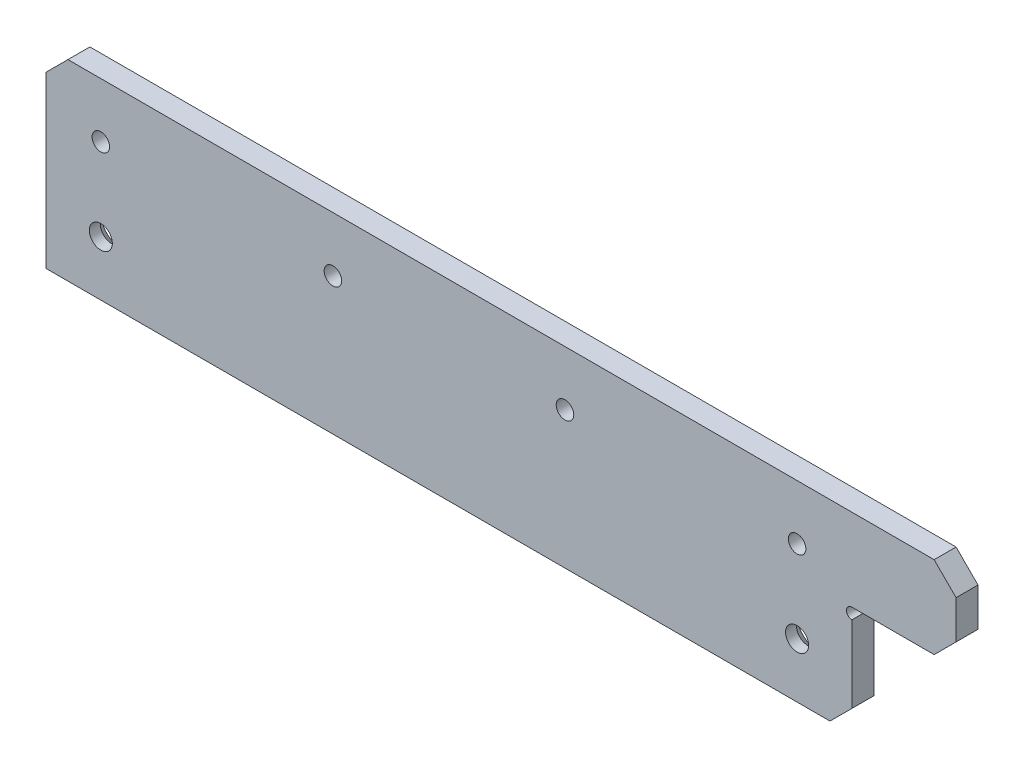
from build123d import *

# Parameters (mm, degrees)
SKETCH_1_W          = 147
SKETCH_1_H          = 35
EXTRUDE_1_DEPTH     = 2
SKETCH_2_W          = 19
SKETCH_2_H          = 15
EXTRUDE_2_DEPTH     = 4
SKETCH_3_R          = 2.1
CUT_EXTRUDE_1_DEPTH = 95.225792647
CHAMFER_1_SIZE      = 4
SKETCH_4_R          = 1
CUT_EXTRUDE_2_DEPTH = 95.225792647
SKETCH_5_R          = 1.6
CUT_EXTRUDE_3_DEPTH = 95.225792647
CHAMFER_2_SIZE      = 2


with BuildPart() as part:
    # 草图1 → 凸台-拉伸1 (new, symmetric)
    with BuildSketch(Plane.XY):
        Rectangle(SKETCH_1_W, SKETCH_1_H)
    extrude(amount=EXTRUDE_1_DEPTH, both=True)

    # 草图2 → 凸台-拉伸2 (add)
    with BuildSketch(Plane.XY.offset(2)):
        with Locations((83, 10)):
            Rectangle(SKETCH_2_W, SKETCH_2_H)
    extrude(amount=-EXTRUDE_2_DEPTH)

    # 草图3 → 切除-拉伸1 (cut, through all)
    with BuildSketch(Plane.XY.offset(2)):
        with Locations((-63.5, -7.5)):
            Circle(SKETCH_3_R)
        with Locations((63.5, -7.5)):
            Circle(SKETCH_3_R)
    extrude(amount=-CUT_EXTRUDE_1_DEPTH, mode=Mode.SUBTRACT)

    # 倒角1
    chamfer_1_edges = [part.edges().sort_by_distance(p)[0] for p in [
        (92.5, 17.5, 0),
        (92.5, 2.5, 0),
        (-73.5, 17.5, 0),
        (73.5, -17.5, 0),
    ]]
    chamfer(chamfer_1_edges, length=CHAMFER_1_SIZE)

    # 草图4 → 切除-拉伸2 (cut, through all)
    with BuildSketch(Plane.XY.offset(2)):
        with Locations((73.5, 1.5)):
            Circle(SKETCH_4_R)
    extrude(amount=-CUT_EXTRUDE_2_DEPTH, mode=Mode.SUBTRACT)

    # 草图5 → 切除-拉伸3 (cut, through all)
    with BuildSketch(Plane.XY.offset(2)):
        with Locations((-63.5, 7.5)):
            Circle(SKETCH_5_R)
        with Locations((-21.166666667, 7.5)):
            Circle(SKETCH_5_R)
        with Locations((21.166666667, 7.5)):
            Circle(SKETCH_5_R)
        with Locations((63.5, 7.5)):
            Circle(SKETCH_5_R)
    extrude(amount=-CUT_EXTRUDE_3_DEPTH, mode=Mode.SUBTRACT)

    # 倒角2
    chamfer_2_edges = [part.edges().sort_by_distance(p)[0] for p in [
        (-65.6, -7.5, -2),
        (61.4, -7.5, -2),
    ]]
    chamfer(chamfer_2_edges, length=CHAMFER_2_SIZE)


solid = part.part
